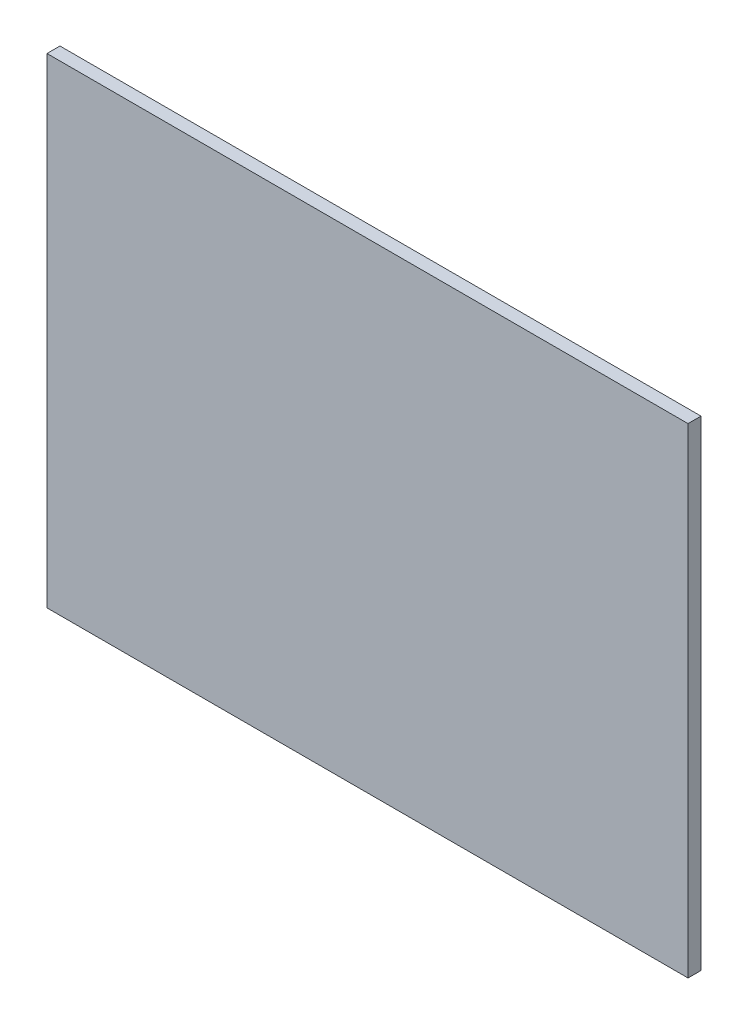
from build123d import *

# Parameters (mm, degrees)
ESQUISSE1_W        = 247
ESQUISSE1_H        = 185
BOSS_EXTRU_1_DEPTH = 5


with BuildPart() as part:
    # Esquisse1 → Boss.-Extru.1 (new body)
    with BuildSketch(Plane.XY):
        with Locations((0, -92.5)):
            Rectangle(ESQUISSE1_W, ESQUISSE1_H)
    extrude(amount=-BOSS_EXTRU_1_DEPTH)


solid = part.part
